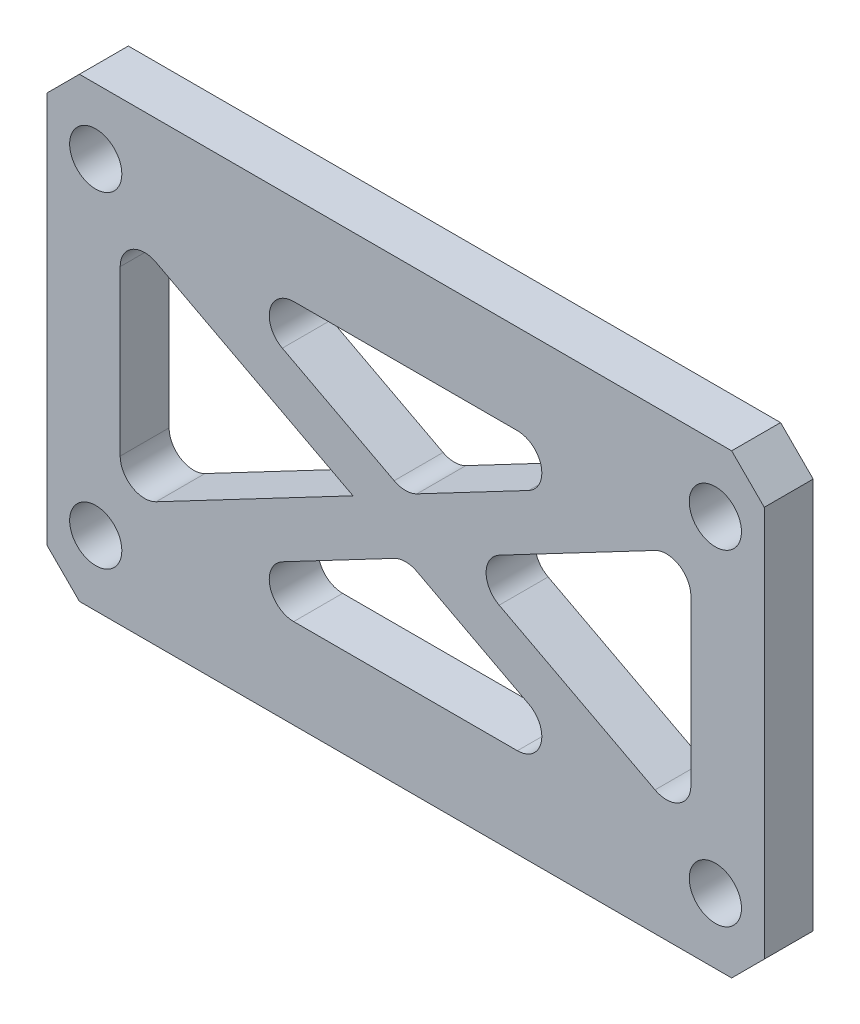
from build123d import *

# Parameters (mm, degrees)
SKETCH_1_W          = 44
SKETCH_1_H          = 28
SKETCH_1_R          = 1.6
EXTRUDE_1_DEPTH     = 3
CUT_EXTRUDE_1_DEPTH = 3
FILLET_1_R          = 1.5
CHAMFER_1_SIZE      = 2


with BuildPart() as part:
    # 草图1 → 凸台-拉伸1 (new body)
    with BuildSketch(Plane.XY):
        Rectangle(SKETCH_1_W, SKETCH_1_H)
        with Locations((-19, 10)):
            Circle(SKETCH_1_R, mode=Mode.SUBTRACT)
        with Locations((-19, -10)):
            Circle(SKETCH_1_R, mode=Mode.SUBTRACT)
        with Locations((19, -10)):
            Circle(SKETCH_1_R, mode=Mode.SUBTRACT)
        with Locations((19, 10)):
            Circle(SKETCH_1_R, mode=Mode.SUBTRACT)
    extrude(amount=EXTRUDE_1_DEPTH)

    # 草图2 → 切除-拉伸1 (cut)
    with BuildSketch(Plane.XY.offset(3)):
        Polygon((-17.5, 7.51545443), (-17.5, -7.51545443), (-3.220636583, 0), align=None)
        Polygon((-12.929363417, 8.5), (0, 1.695071886), (12.929363417, 8.5), align=None)
        Polygon((0, -1.695071886), (-12.929363417, -8.5), (12.929363417, -8.5), align=None)
        Polygon((17.5, 7.51545443), (3.220636583, 0), (17.5, -7.51545443), align=None)
    extrude(amount=-CUT_EXTRUDE_1_DEPTH, mode=Mode.SUBTRACT)

    # 圆角1
    fillet_1_edges = [part.edges().sort_by_distance(p)[0] for p in [
        (0, 1.695071886, 1.5),
        (-12.929363417, 8.5, 1.5),
        (12.929363417, 8.5, 1.5),
        (-12.929363417, -8.5, 1.5),
        (0, -1.695071886, 1.5),
        (12.929363417, -8.5, 1.5),
        (3.220636583, 0, 1.5),
        (17.5, 7.51545443, 1.5),
        (17.5, -7.51545443, 1.5),
        (-17.5, 7.51545443, 1.5),
        (-17.5, -7.51545443, 1.5),
    ]]
    fillet(fillet_1_edges, radius=FILLET_1_R)

    # 倒角1
    chamfer_1_edges = [part.edges().sort_by_distance(p)[0] for p in [
        (22, -14, 1.5),
        (-22, -14, 1.5),
        (-22, 14, 1.5),
        (22, 14, 1.5),
    ]]
    chamfer(chamfer_1_edges, length=CHAMFER_1_SIZE)


solid = part.part
